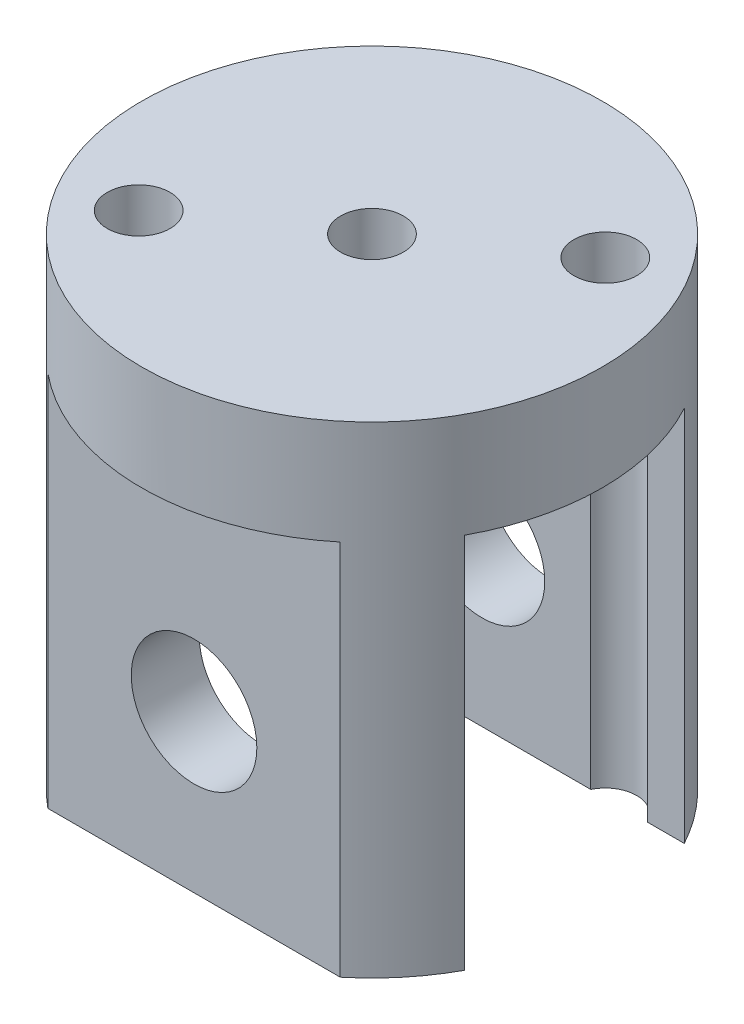
from build123d import *

# Parameters (mm, degrees)
SKETCH_2_R          = 11
EXTRUDE_1_DEPTH     = 23
CUT_EXTRUDE_START   = -8.5
SKETCH_3_W          = 30
SKETCH_3_H          = 18
CUT_EXTRUDE_1_DEPTH = 20.266886754
CUT_EXTRUDE_START_2 = 8.5
SKETCH_3_5_W        = 30
SKETCH_3_5_H        = 18
CUT_EXTRUDE_2_DEPTH = 20.266886754
SKETCH_3_6_W        = 30
SKETCH_3_6_H        = 18
CUT_EXTRUDE_3_DEPTH = 5.25
SKETCH_4_R          = 3
CUT_EXTRUDE_4_DEPTH = 33.097507691
SKETCH_6_R          = 1.5
CUT_EXTRUDE_5_DEPTH = 28.766886754
SKETCH_8_R          = 1.5
CUT_EXTRUDE_6_DEPTH = 28.766886754


with BuildPart() as part:
    # 草图2 → 凸台-拉伸1 (new body)
    with BuildSketch(Plane(origin=(0, 0, 0), x_dir=(1, 0, 0), z_dir=(0, 1, 0))):
        Circle(SKETCH_2_R)
    extrude(amount=EXTRUDE_1_DEPTH)

    # 草图3 → 切除-拉伸1 (cut, through all)
    with BuildSketch(Plane.XY.offset(CUT_EXTRUDE_START)):
        with Locations((4, 9)):
            Rectangle(SKETCH_3_W, SKETCH_3_H)
    extrude(amount=-CUT_EXTRUDE_1_DEPTH, mode=Mode.SUBTRACT)

    # 草图3<5> → 切除-拉伸2 (cut, through all)
    with BuildSketch(Plane.XY.offset(CUT_EXTRUDE_START_2)):
        with Locations((4, 9)):
            Rectangle(SKETCH_3_5_W, SKETCH_3_5_H)
    extrude(amount=CUT_EXTRUDE_2_DEPTH, mode=Mode.SUBTRACT)

    # 草图3<6> → 切除-拉伸3 (cut, symmetric)
    with BuildSketch(Plane.XY):
        with Locations((4, 9)):
            Rectangle(SKETCH_3_6_W, SKETCH_3_6_H)
    extrude(amount=CUT_EXTRUDE_3_DEPTH, both=True, mode=Mode.SUBTRACT)

    # 草图4 → 切除-拉伸4 (cut, through all)
    with BuildSketch(Plane.XY.offset(8.5)):
        with Locations((0, 7.5)):
            Circle(SKETCH_4_R)
    extrude(amount=-CUT_EXTRUDE_4_DEPTH, mode=Mode.SUBTRACT)

    # 草图6 → 切除-拉伸5 (cut, through all)
    with BuildSketch(Plane(origin=(0, 23, 0), x_dir=(1, 0, 0), z_dir=(0, 1, 0))):
        Circle(SKETCH_6_R)
    extrude(amount=-CUT_EXTRUDE_5_DEPTH, mode=Mode.SUBTRACT)

    # 草图8 → 切除-拉伸6 (cut, through all)
    with BuildSketch(Plane(origin=(0, 23, 0), x_dir=(1, 0, 0), z_dir=(0, 1, 0))):
        with Locations((-6.547985936, -4.596072256)):
            Circle(SKETCH_8_R)
        with Locations((6.547985936, 4.596072256)):
            Circle(SKETCH_8_R)
    extrude(amount=-CUT_EXTRUDE_6_DEPTH, mode=Mode.SUBTRACT)


solid = part.part
